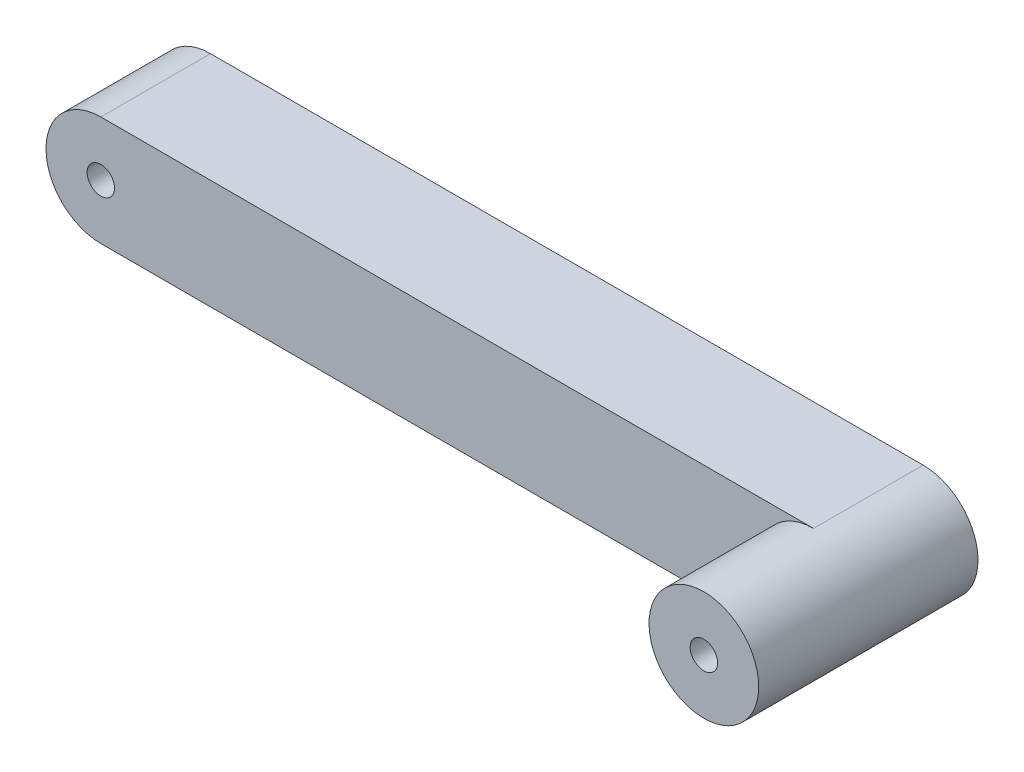
from build123d import *

# Parameters (mm, degrees)
SKETCH_1_R      = 0.5
EXTRUDE_1_DEPTH = 4
SKETCH_2_R      = 2
SKETCH_2_R_2    = 0.5
EXTRUDE_2_DEPTH = 4


with BuildPart() as part:
    # 草图1 → 凸台-拉伸1 (new body)
    with BuildSketch(Plane.XY):
        with BuildLine():
            Line((0, 2), (26, 2))
            ThreePointArc((26, 2), (28, 0), (26, -2))
            Line((26, -2), (0, -2))
            ThreePointArc((0, -2), (-2, 0), (0, 2))
        make_face()
        Circle(SKETCH_1_R, mode=Mode.SUBTRACT)
        with Locations((26, 0)):
            Circle(SKETCH_1_R, mode=Mode.SUBTRACT)
    extrude(amount=EXTRUDE_1_DEPTH)

    # 草图2 → 凸台-拉伸2 (add)
    with BuildSketch(Plane.XY.offset(4)):
        with Locations(Location((26, 0, 0), (0, 0, 90))):
            Circle(SKETCH_2_R)
        with Locations((26, 0)):
            Circle(SKETCH_2_R_2, mode=Mode.SUBTRACT)
    extrude(amount=EXTRUDE_2_DEPTH)


solid = part.part
